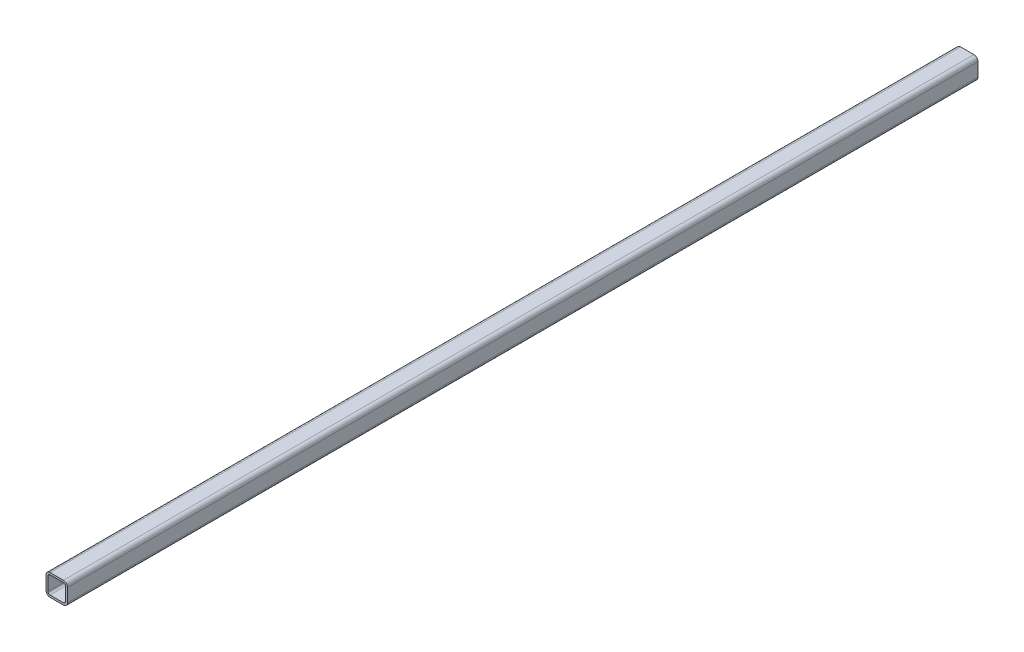
from build123d import *

# Parameters (mm, degrees)
DODANIE_WYCI_GNI_CIE1_DEPTH = 2150.8


with BuildPart() as part:
    # Szkic1 → Dodanie-wyciągnięcie1 (new body)
    with BuildSketch(Plane.XY):
        with BuildLine():
            Line((9.53, 0), (41.27, 0))
            ThreePointArc((41.27, 0), (48.008727625, 2.791272375), (50.8, 9.53))
            Line((50.8, 9.53), (50.8, 41.27))
            ThreePointArc((50.8, 41.27), (48.008727625, 48.008727625), (41.27, 50.8))
            Line((41.27, 50.8), (9.53, 50.8))
            ThreePointArc((9.53, 50.8), (2.791272375, 48.008727625), (0, 41.27))
            Line((0, 41.27), (0, 9.53))
            ThreePointArc((0, 9.53), (2.791272375, 2.791272375), (9.53, 0))
        make_face()
        with BuildLine():
            Line((9.52, 46.04), (41.28, 46.04))
            ThreePointArc((41.28, 46.04), (44.645828278, 44.645828278), (46.04, 41.28))
            Line((46.04, 41.28), (46.04, 9.52))
            ThreePointArc((46.04, 9.52), (44.645828278, 6.154171722), (41.28, 4.76))
            Line((41.28, 4.76), (9.52, 4.76))
            ThreePointArc((9.52, 4.76), (6.154171722, 6.154171722), (4.76, 9.52))
            Line((4.76, 9.52), (4.76, 41.28))
            ThreePointArc((4.76, 41.28), (6.154171722, 44.645828278), (9.52, 46.04))
        make_face(mode=Mode.SUBTRACT)
    extrude(amount=DODANIE_WYCI_GNI_CIE1_DEPTH)


solid = part.part
